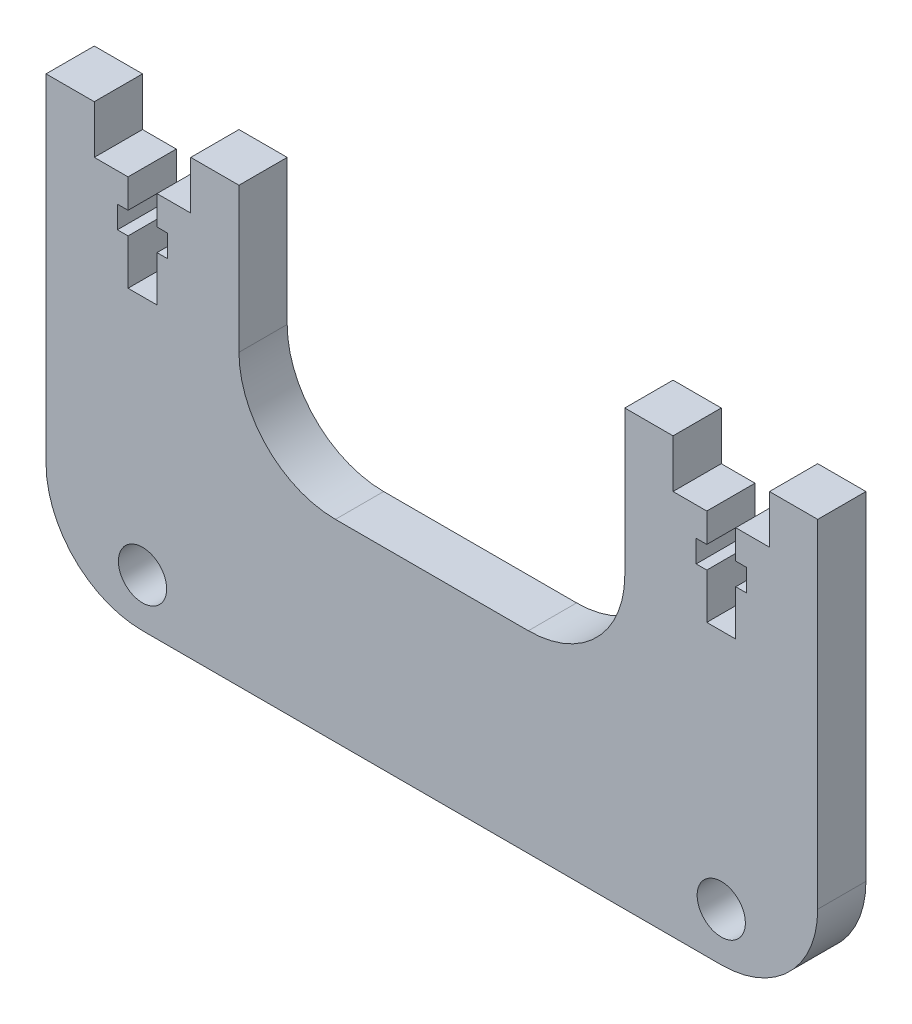
from build123d import *

# Parameters (mm, degrees)
ESQUISSE1_R        = 2.5
BOSS_EXTRU_1_DEPTH = 5
CONG_1_R           = 10


with BuildPart() as part:
    # Esquisse1 → Boss.-Extru.1 (new body)
    with BuildSketch(Plane.XY):
        Polygon((-31.5, -3), (-32.6, -3), (-32.6, -5.3), (-31.5, -5.3), (-31.5, -10), (-28.5, -10), (-28.5, -5.3), (-27.4, -5.3), (-27.4, -3), (-28.5, -3), (-28.5, 0), (-25, 0), (-25, 5), (-20, 5), (-20, 0), (-20, -20), (20, -20), (20, 0), (20, 5), (25, 5), (25, 0), (28.5, 0), (28.5, -3), (27.4, -3), (27.4, -5.3), (28.5, -5.3), (28.5, -10), (31.5, -10), (31.5, -5.3), (32.6, -5.3), (32.6, -3), (31.5, -3), (31.5, 0), (35, 0), (35, 5), (40, 5), (40, 0), (40, -40), (-40, -40), (-40, 0), (-40, 5), (-35, 5), (-35, 0), (-31.5, 0), align=None)
        with Locations((30, -35)):
            Circle(ESQUISSE1_R, mode=Mode.SUBTRACT)
        with Locations((-30, -35)):
            Circle(ESQUISSE1_R, mode=Mode.SUBTRACT)
    extrude(amount=BOSS_EXTRU_1_DEPTH)

    # Congé1
    cong_1_edges = [part.edges().sort_by_distance(p)[0] for p in [
        (-20, -20, 2.5),
        (20, -20, 2.5),
        (40, -40, 2.5),
        (-40, -40, 2.5),
    ]]
    fillet(cong_1_edges, radius=CONG_1_R)


solid = part.part
